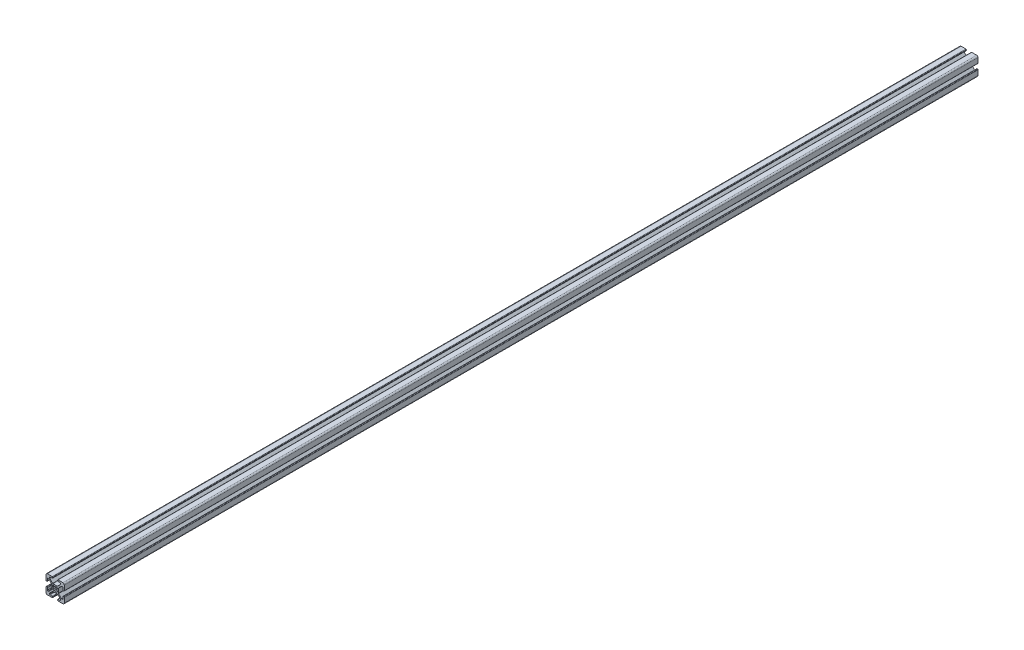
from build123d import *

# Parameters (mm, degrees)
BOSS_EXTRUDE1_DEPTH = 1000


with BuildPart() as part:
    # Sketch2 → Boss-Extrude1 (new body)
    with BuildSketch(Plane.XY):
        with BuildLine():
            Line((-10, -3.138), (-10, -8.5))
            ThreePointArc((-10, -8.5), (-9.560660172, -9.560660172), (-8.5, -10))
            Line((-8.5, -10), (-3.138, -10))
            ThreePointArc((-3.138, -10), (-2.778789755, -9.851210245), (-2.63, -9.492))
            Line((-2.63, -9.492), (-2.63, -9.008))
            ThreePointArc((-2.63, -9.008), (-2.778789755, -8.648789755), (-3.138, -8.5))
            Line((-3.138, -8.5), (-5.487, -8.5))
            ThreePointArc((-5.487, -8.5), (-5.846210245, -8.351210245), (-5.995, -7.992))
            Line((-5.995, -7.992), (-5.995, -7.266240833))
            ThreePointArc((-5.995, -7.266240833), (-5.956330803, -7.07183765), (-5.846210245, -6.907030588))
            Line((-5.846210245, -6.907030588), (-2.742969412, -3.803789755))
            ThreePointArc((-2.742969412, -3.803789755), (-2.57816235, -3.693669197), (-2.383759167, -3.655))
            Line((-2.383759167, -3.655), (2.38407951, -3.655))
            ThreePointArc((2.38407951, -3.655), (2.578482694, -3.693669197), (2.743289755, -3.803789755))
            Line((2.743289755, -3.803789755), (5.846210245, -6.906710245))
            ThreePointArc((5.846210245, -6.906710245), (5.956330803, -7.071517306), (5.995, -7.26592049))
            Line((5.995, -7.26592049), (5.995, -7.992))
            ThreePointArc((5.995, -7.992), (5.846210245, -8.351210245), (5.487, -8.5))
            Line((5.487, -8.5), (3.138, -8.5))
            ThreePointArc((3.138, -8.5), (2.778789755, -8.648789755), (2.63, -9.008))
            Line((2.63, -9.008), (2.63, -9.492))
            ThreePointArc((2.63, -9.492), (2.778789755, -9.851210245), (3.138, -10))
            Line((3.138, -10), (8.5, -10))
            ThreePointArc((8.5, -10), (9.560660172, -9.560660172), (10, -8.5))
            Line((10, -8.5), (10, -3.138))
            ThreePointArc((10, -3.138), (9.851210245, -2.778789755), (9.492, -2.63))
            Line((9.492, -2.63), (9.008, -2.63))
            ThreePointArc((9.008, -2.63), (8.648789755, -2.778789755), (8.5, -3.138))
            Line((8.5, -3.138), (8.5, -5.487))
            ThreePointArc((8.5, -5.487), (8.351210245, -5.846210245), (7.992, -5.995))
            Line((7.992, -5.995), (7.266240833, -5.995))
            ThreePointArc((7.266240833, -5.995), (7.07183765, -5.956330803), (6.907030588, -5.846210245))
            Line((6.907030588, -5.846210245), (3.803789755, -2.742969412))
            ThreePointArc((3.803789755, -2.742969412), (3.693669197, -2.57816235), (3.655, -2.383759167))
            Line((3.655, -2.383759167), (3.655, 2.38407951))
            ThreePointArc((3.655, 2.38407951), (3.693669197, 2.578482694), (3.803789755, 2.743289755))
            Line((3.803789755, 2.743289755), (6.906710245, 5.846210245))
            ThreePointArc((6.906710245, 5.846210245), (7.071517306, 5.956330803), (7.26592049, 5.995))
            Line((7.26592049, 5.995), (7.992, 5.995))
            ThreePointArc((7.992, 5.995), (8.351210245, 5.846210245), (8.5, 5.487))
            Line((8.5, 5.487), (8.5, 3.138))
            ThreePointArc((8.5, 3.138), (8.648789755, 2.778789755), (9.008, 2.63))
            Line((9.008, 2.63), (9.492, 2.63))
            ThreePointArc((9.492, 2.63), (9.851210245, 2.778789755), (10, 3.138))
            Line((10, 3.138), (10, 8.5))
            ThreePointArc((10, 8.5), (9.560660172, 9.560660172), (8.5, 10))
            Line((8.5, 10), (3.138, 10))
            ThreePointArc((3.138, 10), (2.778789755, 9.851210245), (2.63, 9.492))
            Line((2.63, 9.492), (2.63, 9.008))
            ThreePointArc((2.63, 9.008), (2.778789755, 8.648789755), (3.138, 8.5))
            Line((3.138, 8.5), (5.487, 8.5))
            ThreePointArc((5.487, 8.5), (5.846210245, 8.351210245), (5.995, 7.992))
            Line((5.995, 7.992), (5.995, 7.266240833))
            ThreePointArc((5.995, 7.266240833), (5.956330803, 7.07183765), (5.846210245, 6.907030588))
            Line((5.846210245, 6.907030588), (2.742969412, 3.803789755))
            ThreePointArc((2.742969412, 3.803789755), (2.57816235, 3.693669197), (2.383759167, 3.655))
            Line((2.383759167, 3.655), (-2.38407951, 3.655))
            ThreePointArc((-2.38407951, 3.655), (-2.578482694, 3.693669197), (-2.743289755, 3.803789755))
            Line((-2.743289755, 3.803789755), (-5.846210245, 6.906710245))
            ThreePointArc((-5.846210245, 6.906710245), (-5.956330803, 7.071517306), (-5.995, 7.26592049))
            Line((-5.995, 7.26592049), (-5.995, 7.992))
            ThreePointArc((-5.995, 7.992), (-5.846210245, 8.351210245), (-5.487, 8.5))
            Line((-5.487, 8.5), (-3.138, 8.5))
            ThreePointArc((-3.138, 8.5), (-2.778789755, 8.648789755), (-2.63, 9.008))
            Line((-2.63, 9.008), (-2.63, 9.492))
            ThreePointArc((-2.63, 9.492), (-2.778789755, 9.851210245), (-3.138, 10))
            Line((-3.138, 10), (-8.5, 10))
            ThreePointArc((-8.5, 10), (-9.560660172, 9.560660172), (-10, 8.5))
            Line((-10, 8.5), (-10, 3.138))
            ThreePointArc((-10, 3.138), (-9.851210245, 2.778789755), (-9.492, 2.63))
            Line((-9.492, 2.63), (-9.008, 2.63))
            ThreePointArc((-9.008, 2.63), (-8.648789755, 2.778789755), (-8.5, 3.138))
            Line((-8.5, 3.138), (-8.5, 5.487))
            ThreePointArc((-8.5, 5.487), (-8.351210245, 5.846210245), (-7.992, 5.995))
            Line((-7.992, 5.995), (-7.266240833, 5.995))
            ThreePointArc((-7.266240833, 5.995), (-7.07183765, 5.956330803), (-6.907030588, 5.846210245))
            Line((-6.907030588, 5.846210245), (-3.803789755, 2.742969412))
            ThreePointArc((-3.803789755, 2.742969412), (-3.693669197, 2.57816235), (-3.655, 2.383759167))
            Line((-3.655, 2.383759167), (-3.655, -2.38407951))
            ThreePointArc((-3.655, -2.38407951), (-3.693669197, -2.578482694), (-3.803789755, -2.743289755))
            Line((-3.803789755, -2.743289755), (-6.906710245, -5.846210245))
            ThreePointArc((-6.906710245, -5.846210245), (-7.071517306, -5.956330803), (-7.26592049, -5.995))
            Line((-7.26592049, -5.995), (-7.992, -5.995))
            ThreePointArc((-7.992, -5.995), (-8.351210245, -5.846210245), (-8.5, -5.487))
            Line((-8.5, -5.487), (-8.5, -3.138))
            ThreePointArc((-8.5, -3.138), (-8.648789755, -2.778789755), (-9.008, -2.63))
            Line((-9.008, -2.63), (-9.492, -2.63))
            ThreePointArc((-9.492, -2.63), (-9.851210245, -2.778789755), (-10, -3.138))
        make_face()
        with BuildLine():
            Line((-2.124493037, 2.304493037), (-2.304493037, 2.124493037))
            ThreePointArc((-2.304493037, 2.124493037), (-2.506016078, 1.35638567), (-1.935777391, 0.803729988))
            ThreePointArc((-1.935777391, 0.803729988), (-2.096, 0), (-1.935777391, -0.803729988))
            ThreePointArc((-1.935777391, -0.803729988), (-2.506016078, -1.35638567), (-2.304493037, -2.124493037))
            Line((-2.304493037, -2.124493037), (-2.124493037, -2.304493037))
            ThreePointArc((-2.124493037, -2.304493037), (-1.35638567, -2.506016078), (-0.803729988, -1.935777391))
            ThreePointArc((-0.803729988, -1.935777391), (0, -2.096), (0.803729988, -1.935777391))
            ThreePointArc((0.803729988, -1.935777391), (1.35638567, -2.506016078), (2.124493037, -2.304493037))
            Line((2.124493037, -2.304493037), (2.304493037, -2.124493037))
            ThreePointArc((2.304493037, -2.124493037), (2.506016078, -1.35638567), (1.935777391, -0.803729988))
            ThreePointArc((1.935777391, -0.803729988), (2.096, 0), (1.935777391, 0.803729988))
            ThreePointArc((1.935777391, 0.803729988), (2.506016078, 1.35638567), (2.304493037, 2.124493037))
            Line((2.304493037, 2.124493037), (2.124493037, 2.304493037))
            ThreePointArc((2.124493037, 2.304493037), (1.35638567, 2.506016078), (0.803729988, 1.935777391))
            ThreePointArc((0.803729988, 1.935777391), (0, 2.096), (-0.803729988, 1.935777391))
            ThreePointArc((-0.803729988, 1.935777391), (-1.35638567, 2.506016078), (-2.124493037, 2.304493037))
        make_face(mode=Mode.SUBTRACT)
    extrude(amount=-BOSS_EXTRUDE1_DEPTH)


solid = part.part
